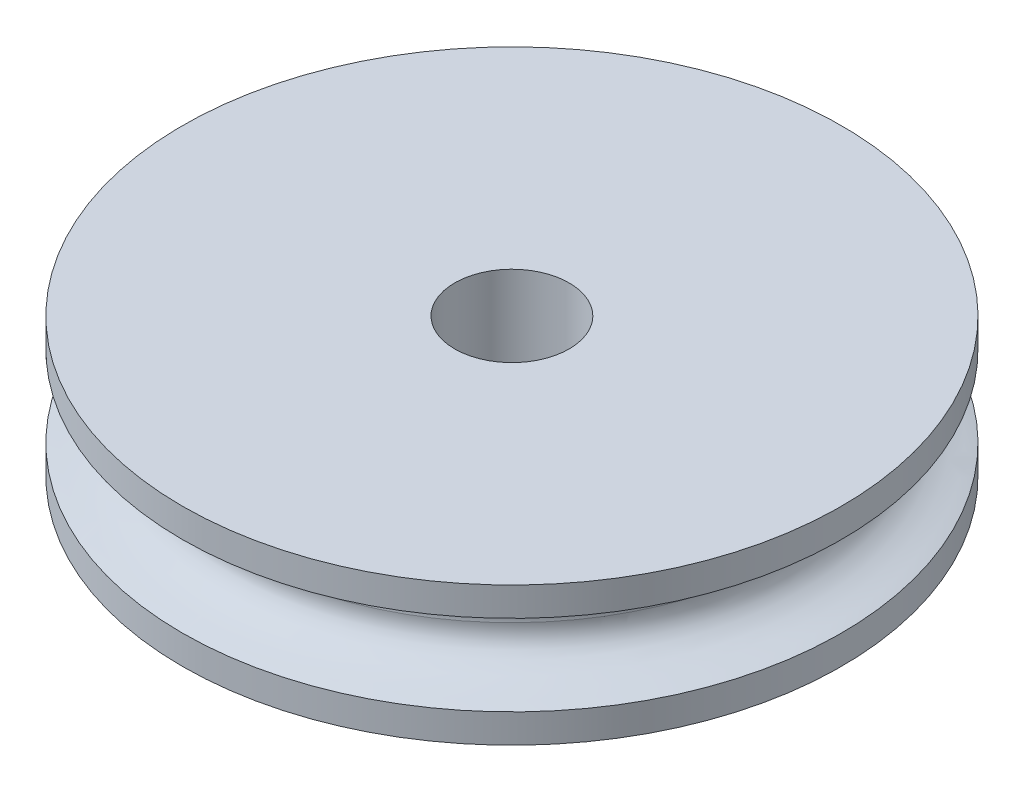
from build123d import *

# Parameters (mm, degrees)
SKETCH1_R           = 9.5
BOSS_EXTRUDE1_DEPTH = 4
SKETCH3_R           = 1.65
CUT_EXTRUDE1_DEPTH  = 15.017845904


with BuildPart() as part:
    # Sketch1 → Boss-Extrude1 (new body)
    with BuildSketch(Plane(origin=(0, 0, 0), x_dir=(1, 0, 0), z_dir=(0, 1, 0))):
        with Locations(Location((0, 0, 0), (0, 0, 270))):
            Circle(SKETCH1_R)
    extrude(amount=BOSS_EXTRUDE1_DEPTH)

    # Sketch2 → Cut-Revolve3 (revolve, cut)
    with BuildSketch(Plane.XY, mode=Mode.PRIVATE) as cut_revolve3_sk:
        with BuildLine():
            Line((-9.5, 3.167174781), (-9.5, 0.832825219))
            add(Edge.make_bspline(
                [(-9.5, 0.832825219), (-8.911003923, 1.01519245), (-7.940181452, 1.15692307), (-8, 2)],
                knots=[0, 0, 0, 0, 1, 1, 1, 1], degree=3))
            add(Edge.make_bspline(
                [(-9.5, 3.167174781), (-8.911003923, 2.98480755), (-7.940181452, 2.84307693), (-8, 2)],
                knots=[0, 0, 0, 0, 1, 1, 1, 1], degree=3))
        make_face()
    revolve(cut_revolve3_sk.sketch.rotate(Axis((0, 4.2, 0), (0, -1, 0)), 270), axis=Axis((0, 4.2, 0), (0, -1, 0)), mode=Mode.SUBTRACT)

    # Sketch3 → Cut-Extrude1 (cut, through all)
    with BuildSketch(Plane(origin=(0, 4, 0), x_dir=(1, 0, 0), z_dir=(0, 1, 0))):
        with Locations(Location((0, 0, 0), (0, 0, 270))):
            Circle(SKETCH3_R)
    extrude(amount=-CUT_EXTRUDE1_DEPTH, mode=Mode.SUBTRACT)


solid = part.part
